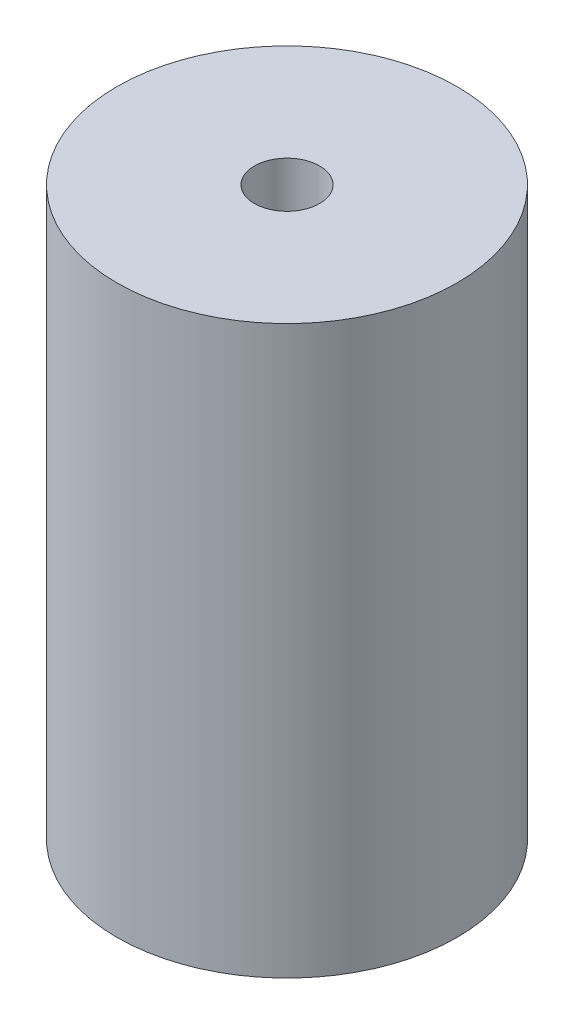
from build123d import *

# Parameters (mm, degrees)
SKETCH1_R           = 6
BOSS_EXTRUDE1_DEPTH = 20
SKETCH2_R           = 1.15
CUT_EXTRUDE1_DEPTH  = 5
SKETCH3_R           = 2.5
CUT_EXTRUDE2_DEPTH  = 5


with BuildPart() as part:
    # Sketch1 → Boss-Extrude1 (new body)
    with BuildSketch(Plane(origin=(0, 0, 0), x_dir=(1, 0, 0), z_dir=(0, 1, 0))):
        with Locations(Location((0, 0, 0), (0, 0, 270))):
            Circle(SKETCH1_R)
    extrude(amount=BOSS_EXTRUDE1_DEPTH)

    # Sketch2 → Cut-Extrude1 (cut)
    with BuildSketch(Plane(origin=(0, 20, 0), x_dir=(1, 0, 0), z_dir=(0, 1, 0))):
        with Locations(Location((0, 0, 0), (0, 0, 270))):
            Circle(SKETCH2_R)
    extrude(amount=-CUT_EXTRUDE1_DEPTH, mode=Mode.SUBTRACT)

    # Sketch3 → Cut-Extrude2 (cut)
    with BuildSketch(Plane.XZ):
        with Locations(Location((0, 0, 0), (0, 0, 270))):
            Circle(SKETCH3_R)
    extrude(amount=-CUT_EXTRUDE2_DEPTH, mode=Mode.SUBTRACT)


solid = part.part
